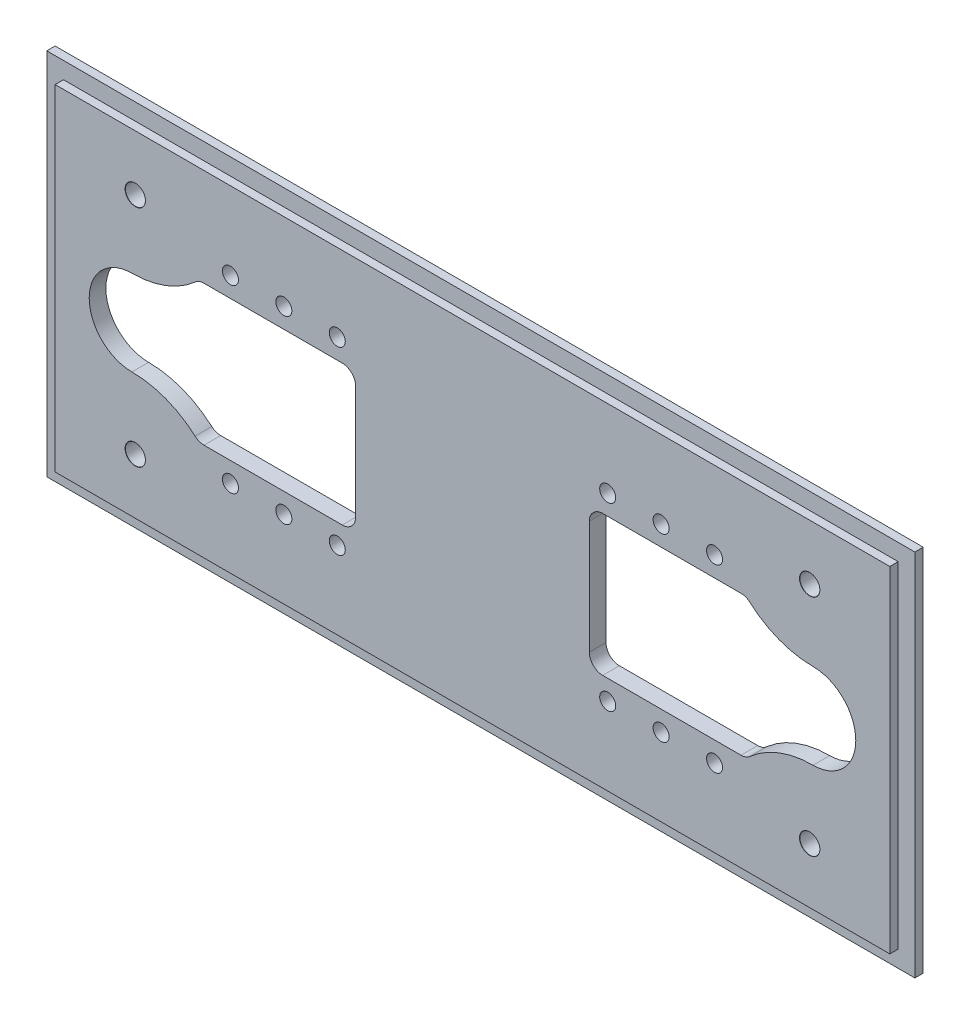
from build123d import *

# Parameters (mm, degrees)
ESBO_O1_W                         = 130
ESBO_O1_H                         = 55.25
RESSALTO_EXTRUS_O1_DEPTH          = 2.5
ESBO_O2_W                         = 130
ESBO_O2_H                         = 55.25
ESBO_O2_W_2                       = 125
ESBO_O2_H_2                       = 50.25
CORTE_EXTRUS_O1_DEPTH             = 1.25
FUROS_GUIA_COM_3_0MM2_D           = 3
FUROS_GUIA_COM_3_0MM2_CSINK_D     = 3.05
FUROS_GUIA_COM_3_0MM2_CSINK_ANGLE = 90
CUT_EXTRUDE1_DEPTH                = 10
FILETE1_R                         = 2
FURO_COM_FOLGA_DE_M21_D           = 2.4
PADR_O_LINEAR1_COUNT              = 3
PADR_O_LINEAR1_PITCH              = 8
ESPELHAR1_COPY_1_D                = 2.4
ESPELHAR1_COPY_2_D                = 2.4
ESPELHAR2_COPY_1_D                = 2.4
ESPELHAR2_COPY_2_D                = 2.4
ESPELHAR2_COPY_3_D                = 2.4
ESPELHAR2_COPY_4_D                = 2.4
ESPELHAR2_COPY_5_D                = 2.4
FILETE1_OF_ESPELHAR2_R            = 2


with BuildPart() as part:
    # Esboço1 → Ressalto-extrusão1 (new body)
    with BuildSketch(Plane.XY):
        with Locations((1.708397535, 5.726309707)):
            Rectangle(ESBO_O1_W, ESBO_O1_H)
    extrude(amount=RESSALTO_EXTRUS_O1_DEPTH)

    # Esboço2 → Corte-extrusão1 (cut)
    with BuildSketch(Plane.XY.offset(2.5)):
        with Locations((1.708397535, 5.726309707)):
            Rectangle(ESBO_O2_W, ESBO_O2_H)
        with Locations((1.708397535, 5.726309707)):
            Rectangle(ESBO_O2_W_2, ESBO_O2_H_2, mode=Mode.SUBTRACT)
    extrude(amount=-CORTE_EXTRUS_O1_DEPTH, mode=Mode.SUBTRACT)

    # Furos-guia com Ø3.0mm2 (through all)
    with Locations(Plane.XY.offset(2.5)):
        with Locations((-48.791602465, 22.551309707), (-48.791602465, -11.098690293), (52.208397535, -11.098690293), (52.208397535, 22.551309707)):
            CounterSinkHole(FUROS_GUIA_COM_3_0MM2_D / 2, FUROS_GUIA_COM_3_0MM2_CSINK_D / 2, counter_sink_angle=FUROS_GUIA_COM_3_0MM2_CSINK_ANGLE)

    # Sketch1 → Cut-Extrude1 (cut)
    with BuildSketch(Plane.XY.offset(2.5)):
        with BuildLine():
            Line((-39.291602465, -4.773695916), (-15.791602465, -4.773695916))
            Line((-15.791602465, -4.773695916), (-15.791602465, 16.226304084))
            Line((-15.791602465, 16.226304084), (-39.291602465, 16.226304084))
            ThreePointArc((-39.291602465, 16.226304084), (-43.887668713, 13.19109981), (-49.291602465, 12.126304084))
            ThreePointArc((-49.291602465, 12.126304084), (-55.691602465, 5.726304084), (-49.291602465, -0.673695916))
            ThreePointArc((-49.291602465, -0.673695916), (-43.887668713, -1.738491642), (-39.291602465, -4.773695916))
        make_face()
    cut_extrude1 = extrude(amount=-CUT_EXTRUDE1_DEPTH, mode=Mode.SUBTRACT)

    # Filete1
    filete1_edges = [part.edges().sort_by_distance(p)[0] for p in [
        (-39.291602465, -4.773695916, 1.25),
        (-39.291602465, 16.226304084, 1.25),
        (-15.791602465, 16.226304084, 1.25),
        (-15.791602465, -4.773695916, 1.25),
    ]]
    fillet(filete1_edges, radius=FILETE1_R)

    # Furo com folga de M21 (through all)
    with Locations(Plane.XY.offset(2.5)):
        with Locations((37.958397535, -7.773690293)):
            furo_com_folga_de_m21 = Hole(FURO_COM_FOLGA_DE_M21_D / 2)

    # Padrão linear1: Furo com folga de M21 ×3
    with Locations(*[(-i * PADR_O_LINEAR1_PITCH, 0, 0) for i in range(1, PADR_O_LINEAR1_COUNT)]):
        add(furo_com_folga_de_m21, mode=Mode.SUBTRACT)

    # Espelhar1: Furo com folga de M21 across plane
    add(furo_com_folga_de_m21.mirror(Plane(origin=(0, 5.726309707, 0), x_dir=(0, 0, 1), z_dir=(0, -1, 0))), mode=Mode.SUBTRACT)

    # Espelhar1 copy 1 (through all)
    with Locations(Plane(origin=(-8, 11.452619414, 2.5), x_dir=(1, 0, 0), z_dir=(0, 0, 1))):
        with Locations((37.958397535, 7.773690293)):
            Hole(ESPELHAR1_COPY_1_D / 2)

    # Espelhar1 copy 2 (through all)
    with Locations(Plane(origin=(-16, 11.452619414, 2.5), x_dir=(1, 0, 0), z_dir=(0, 0, 1))):
        with Locations((37.958397535, 7.773690293)):
            Hole(ESPELHAR1_COPY_2_D / 2)

    # Espelhar2: Cut-Extrude1, Furo com folga de M21 across plane
    add(cut_extrude1.mirror(Plane(origin=(1.708397535, 0, 0), x_dir=(0, 0, 1), z_dir=(1, 0, 0))), mode=Mode.SUBTRACT)
    add(furo_com_folga_de_m21.mirror(Plane(origin=(1.708397535, 0, 0), x_dir=(0, 0, 1), z_dir=(1, 0, 0))), mode=Mode.SUBTRACT)

    # Espelhar2 copy 1 (through all)
    with Locations(Plane(origin=(11.416795069, 0, 2.5), x_dir=(-1, 0, 0), z_dir=(0, 0, 1))):
        with Locations((37.958397535, 7.773690293)):
            Hole(ESPELHAR2_COPY_1_D / 2)

    # Espelhar2 copy 2 (through all)
    with Locations(Plane(origin=(19.416795069, 0, 2.5), x_dir=(-1, 0, 0), z_dir=(0, 0, 1))):
        with Locations((37.958397535, 7.773690293)):
            Hole(ESPELHAR2_COPY_2_D / 2)

    # Espelhar2 copy 3 (through all)
    with Locations(Plane(origin=(3.416795069, 11.452619414, 2.5), x_dir=(-1, 0, 0), z_dir=(0, 0, 1))):
        with Locations((37.958397535, -7.773690293)):
            Hole(ESPELHAR2_COPY_3_D / 2)

    # Espelhar2 copy 4 (through all)
    with Locations(Plane(origin=(11.416795069, 11.452619414, 2.5), x_dir=(-1, 0, 0), z_dir=(0, 0, 1))):
        with Locations((37.958397535, -7.773690293)):
            Hole(ESPELHAR2_COPY_4_D / 2)

    # Espelhar2 copy 5 (through all)
    with Locations(Plane(origin=(19.416795069, 11.452619414, 2.5), x_dir=(-1, 0, 0), z_dir=(0, 0, 1))):
        with Locations((37.958397535, -7.773690293)):
            Hole(ESPELHAR2_COPY_5_D / 2)

    # Filete1 of Espelhar2
    filete1_of_espelhar2_edges = [part.edges().sort_by_distance(p)[0] for p in [
        (42.708397535, -4.773695916, 1.25),
        (42.708397535, 16.226304084, 1.25),
        (19.208397535, 16.226304084, 1.25),
        (19.208397535, -4.773695916, 1.25),
    ]]
    fillet(filete1_of_espelhar2_edges, radius=FILETE1_OF_ESPELHAR2_R)


solid = part.part
